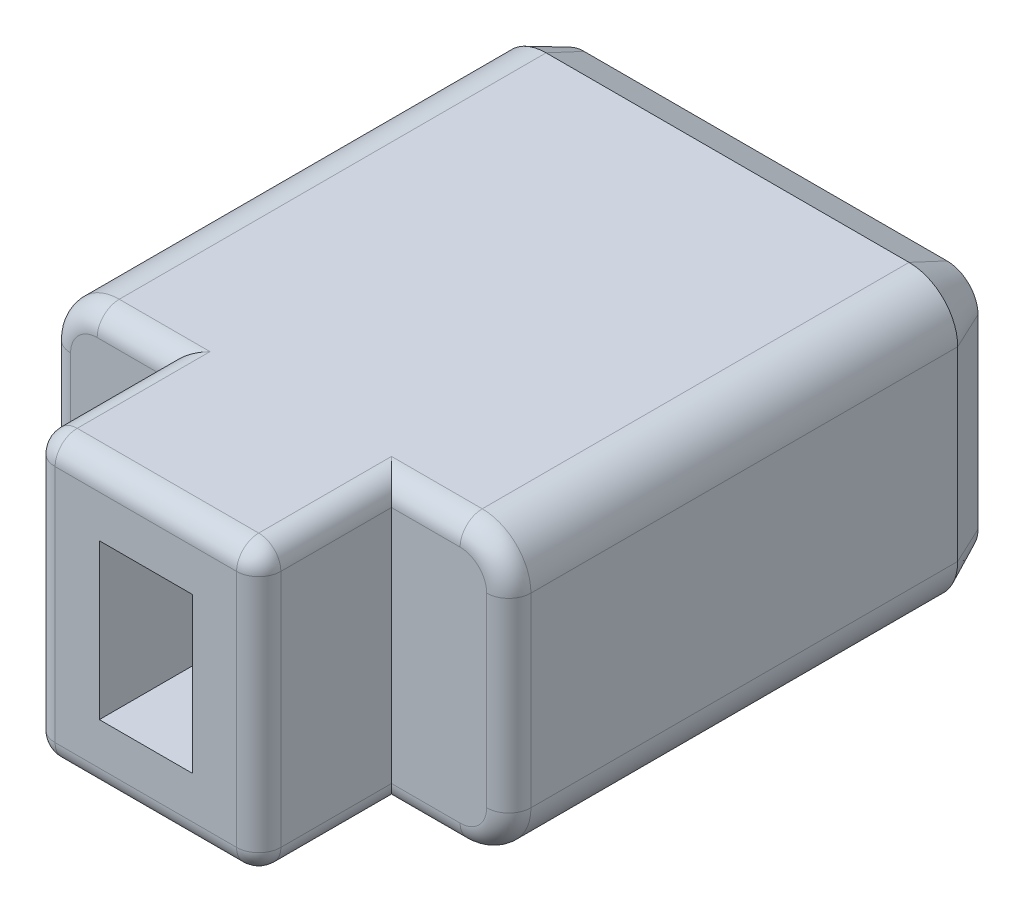
from build123d import *

# Parameters (mm, degrees)
BOSS_EXTRU_1_DEPTH      = 14
ESQUISSE3_W             = 2.1
ESQUISSE3_H             = 3.5
ENL_V_MAT_EXTRU_1_DEPTH = 3
ESQUISSE4_OUTSIDE_W     = 16.116
ESQUISSE4_OUTSIDE_H     = 12.116
ESQUISSE4_OUTSIDE_W_2   = 5.1
ESQUISSE4_OUTSIDE_H_2   = 6.4
ENL_V_MAT_EXTRU_2_DEPTH = 3
CONG_1_R                = 0.5
CHANFREIN1_SIZE         = 0.4
CHANFREIN1_SIZE2        = 0.857802768
ENL_V_MAT_EXTRU_3_DEPTH = 0.3
BOSS_EXTRU_2_DEPTH      = 0.3
BOSS_EXTRU_2_2_DEPTH    = 0.3
BOSS_EXTRU_2_3_DEPTH    = 0.3


with BuildPart() as part:
    # Esquisse2 → Boss.-Extru.1 (new body)
    with BuildSketch(Plane.XY):
        with BuildLine():
            Line((1.1, 0), (9.3, 0))
            ThreePointArc((9.3, 0), (10.077817459, 0.322182541), (10.4, 1.1))
            Line((10.4, 1.1), (10.4, 5.3))
            ThreePointArc((10.4, 5.3), (10.077817459, 6.077817459), (9.3, 6.4))
            Line((9.3, 6.4), (1.1, 6.4))
            ThreePointArc((1.1, 6.4), (0.322182541, 6.077817459), (0, 5.3))
            Line((0, 5.3), (0, 1.1))
            ThreePointArc((0, 1.1), (0.322182541, 0.322182541), (1.1, 0))
        make_face()
    extrude(amount=BOSS_EXTRU_1_DEPTH)

    # Esquisse3 → Enlèv. mat.-Extru.1 (cut)
    with BuildSketch(Plane.XY.offset(14)):
        with Locations((5.2, 3.2)):
            Rectangle(ESQUISSE3_W, ESQUISSE3_H)
    extrude(amount=-ENL_V_MAT_EXTRU_1_DEPTH, mode=Mode.SUBTRACT)

    # Esquisse4 outside → Enlèv. mat.-Extru.2 (cut)
    with BuildSketch(Plane.XY.offset(14)):
        with Locations((5.2, 3.2)):
            Rectangle(ESQUISSE4_OUTSIDE_W, ESQUISSE4_OUTSIDE_H)
        with Locations((5.2, 3.2)):
            Rectangle(ESQUISSE4_OUTSIDE_W_2, ESQUISSE4_OUTSIDE_H_2, mode=Mode.SUBTRACT)
    extrude(amount=-ENL_V_MAT_EXTRU_2_DEPTH, mode=Mode.SUBTRACT)

    # Congé1
    cong_1_edges = [part.edges().sort_by_distance(p)[0] for p in [
        (8.525, 0, 11),
        (10.077817459, 0.322182541, 11),
        (10.4, 3.2, 11),
        (10.077817459, 6.077817459, 11),
        (1.875, 6.4, 11),
        (0.322182541, 6.077817459, 11),
        (1.875, 0, 11),
        (0.322182541, 0.322182541, 11),
        (7.75, 6.4, 12.5),
        (2.65, 6.4, 12.5),
        (7.75, 0, 12.5),
        (2.65, 0, 12.5),
        (2.65, 3.2, 14),
        (5.2, 6.4, 14),
        (7.75, 3.2, 14),
        (5.2, 0, 14),
        (8.525, 6.4, 11),
        (0, 3.2, 11),
    ]]
    fillet(cong_1_edges, radius=CONG_1_R)

    # Chanfrein1
    chanfrein1_edges = [part.edges().sort_by_distance(p)[0] for p in [
        (5.2, 0, 0),
        (10.077817459, 0.322182541, 0),
        (0.322182541, 0.322182541, 0),
        (10.4, 3.2, 0),
        (0, 3.2, 0),
        (10.077817459, 6.077817459, 0),
        (0.322182541, 6.077817459, 0),
        (5.2, 6.4, 0),
    ]]
    chanfrein1_side = [part.faces().sort_by_distance(p)[0] for p in [
        (5.2, 3.2, 0),
    ]]
    chamfer(chanfrein1_edges, length=CHANFREIN1_SIZE, length2=CHANFREIN1_SIZE2, reference=chanfrein1_side[0])

    # Esquisse5 → Enlèv. mat.-Extru.3 (cut)
    # profile 1 of 3: a face of its own
    with BuildSketch(Plane(origin=(0, 0, 0), x_dir=(-1, 0, 0), z_dir=(0, 0, -1))):
        with BuildLine():
            Line((-4.276923077, 2.033974359), (-4.000480769, 2.274358974))
            add(Edge.make_bspline(
                [(-4.000480769, 2.274358974), (-3.962102197, 2.222140609), (-3.886775783, 2.119650549), (-3.755756238, 1.984141613), (-3.613251162, 1.868933007), (-3.460095419, 1.773322739), (-3.29682901, 1.69968982), (-3.125457967, 1.646548969), (-2.946218196, 1.613219489), (-2.823810126, 1.609552821), (-2.761698718, 1.607692308)],
                knots=[0, 0, 0, 0, 1.059844169, 2.080177969, 3.074997252, 4.05282142, 5.027209033, 5.99793136, 6.984124963, 8, 8, 8, 8], degree=3))
            add(Edge.make_bspline(
                [(-2.761698718, 1.607692308), (-2.727474352, 1.608152442), (-2.659369594, 1.609068087), (-2.558253532, 1.62123278), (-2.45882019, 1.638378111), (-2.361532921, 1.663255399), (-2.266556515, 1.696027084), (-2.172534217, 1.733781483), (-2.081443986, 1.780884494), (-1.992377993, 1.833527867), (-1.907144766, 1.892677342), (-1.82605109, 1.956898185), (-1.749694689, 2.02564327), (-1.679105422, 2.100108345), (-1.612383779, 2.178273853), (-1.551325074, 2.261850409), (-1.496181054, 2.350656354), (-1.444797072, 2.443188098), (-1.399109124, 2.540018487), (-1.360034227, 2.640574138), (-1.326030175, 2.743961711), (-1.299222293, 2.850648963), (-1.277282703, 2.959686125), (-1.262071354, 3.071811804), (-1.253313907, 3.18687754), (-1.251963406, 3.264728865), (-1.251282051, 3.30400641)],
                knots=[0, 0, 0, 0, 0.97289461, 1.936011137, 2.892754515, 3.841684151, 4.788238795, 5.748985364, 6.720692793, 7.701769213, 8.6901134, 9.668951799, 10.6424691, 11.609651951, 12.585301174, 13.563874206, 14.550347966, 15.556832669, 16.572962131, 17.592946595, 18.623597964, 19.666496227, 20.719856773, 21.785663574, 22.88282314, 24, 24, 24, 24], degree=3))
            add(Edge.make_bspline(
                [(-1.251282051, 3.30400641), (-1.252296991, 3.363107044), (-1.254287635, 3.479023632), (-1.276329854, 3.64883825), (-1.309111755, 3.811628739), (-1.357692697, 3.966485248), (-1.418706228, 4.11418425), (-1.493512611, 4.254523099), (-1.582914401, 4.386715435), (-1.68417268, 4.510513554), (-1.795775953, 4.622968802), (-1.915058284, 4.722122176), (-2.042287881, 4.805539023), (-2.176366905, 4.873751047), (-2.317892379, 4.927390857), (-2.466681504, 4.964264703), (-2.622262689, 4.988840334), (-2.728482199, 4.991138347), (-2.782532051, 4.992307692)],
                knots=[0, 0, 0, 0, 1.112954785, 2.182885596, 3.221232596, 4.238398056, 5.235647242, 6.228569394, 7.229380626, 8.237855998, 9.237844397, 10.210210665, 11.155206134, 12.098269864, 13.039545894, 14.000171849, 14.982386428, 16, 16, 16, 16], degree=3))
            add(Edge.make_bspline(
                [(-2.782532051, 4.992307692), (-2.841968738, 4.990370489), (-2.959281408, 4.98654695), (-3.131353159, 4.954167609), (-3.296160274, 4.90194349), (-3.45347852, 4.828445211), (-3.602855159, 4.733536845), (-3.744357048, 4.617761095), (-3.879249498, 4.481775907), (-3.959339012, 4.378627877), (-4.000480769, 4.325641026)],
                knots=[0, 0, 0, 0, 0.98701547, 1.94811365, 2.898400414, 3.853494756, 4.825030655, 5.831532994, 6.886064627, 8, 8, 8, 8], degree=3))
            Line((-4.000480769, 4.325641026), (-4.276923077, 4.563621795))
            add(Edge.make_bspline(
                [(-4.276923077, 4.563621795), (-4.255144937, 4.596218141), (-4.211783743, 4.661118837), (-4.140480519, 4.752603201), (-4.065765531, 4.83891057), (-3.987049712, 4.919139706), (-3.904369455, 4.994138271), (-3.816977162, 5.062661573), (-3.726194432, 5.126321568), (-3.631651093, 5.184250318), (-3.533153339, 5.235097115), (-3.432039281, 5.280594637), (-3.327599133, 5.31771745), (-3.220882842, 5.34985195), (-3.110732473, 5.372107074), (-2.998305425, 5.390367274), (-2.882894474, 5.400883872), (-2.804988075, 5.402000874), (-2.765705128, 5.402564103)],
                knots=[0, 0, 0, 0, 1.041374987, 2.073421428, 3.079568686, 4.073273683, 5.058170465, 6.043552977, 7.022087575, 8.003141192, 8.987193764, 9.965779835, 10.946859123, 11.930527725, 12.924384778, 13.93018154, 14.956330036, 16, 16, 16, 16], degree=3))
            add(Edge.make_bspline(
                [(-2.765705128, 5.402564103), (-2.72828973, 5.402267935), (-2.654417621, 5.401683189), (-2.545370148, 5.392066353), (-2.439100683, 5.378934925), (-2.33597401, 5.35932637), (-2.235319604, 5.335948637), (-2.138310249, 5.304703061), (-2.04375213, 5.270139818), (-1.952704211, 5.228667823), (-1.864505778, 5.18240408), (-1.779285018, 5.129955518), (-1.696970644, 5.07231767), (-1.617267081, 5.009733107), (-1.541053686, 4.941422954), (-1.468057536, 4.867532053), (-1.398077871, 4.787962989), (-1.354355413, 4.731593845), (-1.332211538, 4.703044872)],
                knots=[0, 0, 0, 0, 1.082168949, 2.13660973, 3.165131306, 4.179150287, 5.172582136, 6.152699036, 7.125936765, 8.084022289, 9.045033083, 10.005950655, 10.977130504, 11.951134984, 12.93626608, 13.936288924, 14.954803513, 16, 16, 16, 16], degree=3))
            add(Edge.make_bspline(
                [(-1.332211538, 4.703044872), (-1.296738988, 4.653214139), (-1.22594324, 4.55376248), (-1.137944828, 4.392857912), (-1.060969548, 4.226187834), (-0.999171455, 4.050939516), (-0.951337208, 3.868102207), (-0.916775683, 3.677681935), (-0.896708809, 3.47965195), (-0.893791903, 3.345184151), (-0.892307692, 3.276762821)],
                knots=[0, 0, 0, 0, 0.965683317, 1.927300737, 2.89231067, 3.86402428, 4.85897487, 5.875476297, 6.918977332, 8, 8, 8, 8], degree=3))
            add(Edge.make_bspline(
                [(-0.892307692, 3.276762821), (-0.893641785, 3.204830865), (-0.89626433, 3.063427756), (-0.923028592, 2.856006965), (-0.964413002, 2.657347371), (-1.02183253, 2.467032718), (-1.097907298, 2.285878807), (-1.190062555, 2.113288295), (-1.299187382, 1.949475621), (-1.423330644, 1.796266238), (-1.559024846, 1.655602283), (-1.705491993, 1.532776269), (-1.861316237, 1.429935291), (-2.02443932, 1.344118513), (-2.196521784, 1.277857782), (-2.377268642, 1.231747218), (-2.566328305, 1.202894235), (-2.695355103, 1.199274587), (-2.760897436, 1.197435897)],
                knots=[0, 0, 0, 0, 1.106177392, 2.174512289, 3.211769933, 4.225704522, 5.227752973, 6.229708733, 7.231529653, 8.251318105, 9.259716566, 10.234142726, 11.185817729, 12.12689365, 13.064806101, 14.01565564, 14.992003525, 16, 16, 16, 16], degree=3))
            add(Edge.make_bspline(
                [(-2.760897436, 1.197435897), (-2.800716264, 1.197990675), (-2.879692456, 1.199091014), (-2.996673033, 1.209733521), (-3.11086361, 1.227538864), (-3.222200709, 1.251488667), (-3.330735386, 1.281814962), (-3.436006637, 1.319508286), (-3.537956256, 1.36487344), (-3.637260964, 1.415732065), (-3.732536634, 1.473741801), (-3.824045288, 1.536821699), (-3.910770806, 1.606203122), (-3.993481357, 1.680567503), (-4.071056102, 1.760895625), (-4.144576419, 1.846347526), (-4.21331182, 1.937571204), (-4.255622291, 2.001692919), (-4.276923077, 2.033974359)],
                knots=[0, 0, 0, 0, 1.055012498, 2.092499289, 3.109576428, 4.116082065, 5.108754671, 6.093853283, 7.076278279, 8.063967189, 9.048429885, 10.030140686, 11.007324681, 11.989571177, 12.975661001, 13.964490532, 14.975242994, 16, 16, 16, 16], degree=3))
        make_face()
    # profile 2 of 3: a face of its own
    with BuildSketch(Plane(origin=(0, 0, 0), x_dir=(-1, 0, 0), z_dir=(0, 0, -1))):
        Polygon((-4.994871795, 1.3), (-5.353846154, 1.3), (-5.353846154, 4.88974359), (-6.687179487, 4.88974359), (-6.687179487, 5.3), (-4.994871795, 5.3), align=None)
    # profile 3 of 3: a face of its own
    with BuildSketch(Plane(origin=(0, 0, 0), x_dir=(-1, 0, 0), z_dir=(0, 0, -1))):
        with BuildLine():
            Line((-7.251282051, 1.3), (-7.953205128, 1.3))
            add(Edge.make_bspline(
                [(-7.953205128, 1.3), (-8.000213275, 1.3001758), (-8.090229963, 1.300512444), (-8.219280641, 1.30243476), (-8.336500089, 1.307883219), (-8.442114803, 1.312567873), (-8.535809249, 1.321160882), (-8.617721249, 1.329228391), (-8.687831754, 1.340225169), (-8.73022515, 1.350001033), (-8.749679487, 1.354487179)],
                knots=[0, 0, 0, 0, 1.410548186, 2.701082353, 3.872164956, 4.931545487, 5.872643019, 6.694846481, 7.4010648, 8, 8, 8, 8], degree=3))
            add(Edge.make_bspline(
                [(-8.749679487, 1.354487179), (-8.775219142, 1.361740702), (-8.826017329, 1.376167905), (-8.898946116, 1.406439045), (-8.968754039, 1.441506074), (-9.035023293, 1.482432658), (-9.096721357, 1.530293066), (-9.155474521, 1.583010705), (-9.209907746, 1.642142742), (-9.261575252, 1.705691029), (-9.30650735, 1.775470425), (-9.347189404, 1.84848438), (-9.380825789, 1.926168245), (-9.408644542, 2.007354342), (-9.430644393, 2.092501008), (-9.445627938, 2.181499618), (-9.454418557, 2.274448402), (-9.455739755, 2.337641421), (-9.456410256, 2.369711538)],
                knots=[0, 0, 0, 0, 0.953163587, 1.89583545, 2.831398256, 3.758060157, 4.68893587, 5.633315694, 6.590672633, 7.573797765, 8.571889309, 9.568272541, 10.573809546, 11.608637311, 12.649011887, 13.729676081, 14.847822807, 16, 16, 16, 16], degree=3))
            add(Edge.make_bspline(
                [(-9.456410256, 2.369711538), (-9.454663057, 2.422954138), (-9.451262795, 2.526570717), (-9.426392336, 2.677261673), (-9.38336416, 2.81754481), (-9.325595668, 2.948255807), (-9.249802259, 3.065244445), (-9.160162217, 3.169018947), (-9.054573529, 3.255709115), (-8.95606583, 3.316142217), (-8.868912965, 3.354829067), (-8.797494165, 3.381850513), (-8.719199942, 3.402787801), (-8.635563808, 3.421281099), (-8.545937966, 3.43568177), (-8.450458638, 3.445914246), (-8.348859215, 3.452378952), (-8.279069705, 3.453348696), (-8.243269231, 3.453846154)],
                knots=[0, 0, 0, 0, 1.376217794, 2.678287309, 3.93428021, 5.161237768, 6.360266741, 7.524963188, 8.691990789, 9.878588042, 10.499780802, 11.155222415, 11.850483239, 12.59271203, 13.369193386, 14.195792071, 15.07448124, 16, 16, 16, 16], degree=3))
            Line((-8.243269231, 3.453846154), (-9.507692308, 5.3))
            Line((-9.507692308, 5.3), (-9.052564103, 5.3))
            Line((-9.052564103, 5.3), (-7.788141026, 3.453846154))
            Line((-7.788141026, 3.453846154), (-7.61025641, 3.453846154))
            Line((-7.61025641, 3.453846154), (-7.61025641, 5.3))
            Line((-7.61025641, 5.3), (-7.251282051, 5.3))
            Line((-7.251282051, 5.3), (-7.251282051, 1.3))
        make_face()
        with BuildLine():
            Line((-7.61025641, 1.71025641), (-7.61025641, 3.043589744))
            Line((-7.61025641, 3.043589744), (-8.216826923, 3.049198718))
            add(Edge.make_bspline(
                [(-8.216826923, 3.049198718), (-8.245146327, 3.049210151), (-8.300214333, 3.049232382), (-8.379809255, 3.044690832), (-8.453879995, 3.039498774), (-8.522068625, 3.031522413), (-8.584666782, 3.021209602), (-8.641475664, 3.008671123), (-8.692610881, 2.993317462), (-8.752501703, 2.970298044), (-8.820426436, 2.934767812), (-8.891408601, 2.879433289), (-8.953648222, 2.813395636), (-9.004622403, 2.736538502), (-9.047111924, 2.652636038), (-9.074842312, 2.561970672), (-9.094965855, 2.46728064), (-9.096601446, 2.402142615), (-9.097435897, 2.368910256)],
                knots=[0, 0, 0, 0, 1.065115818, 2.071152542, 2.998223466, 3.858177936, 4.652718105, 5.384003046, 6.045176779, 6.659081028, 7.796261142, 8.913693857, 10.029725289, 11.194622041, 12.371932755, 13.553993211, 14.752087226, 16, 16, 16, 16], degree=3))
            add(Edge.make_bspline(
                [(-9.097435897, 2.368910256), (-9.096533537, 2.336760519), (-9.094750785, 2.273243778), (-9.075287125, 2.180651775), (-9.045613537, 2.092194398), (-9.004444137, 2.009394504), (-8.952463507, 1.935229452), (-8.892794911, 1.870951797), (-8.825292308, 1.818145247), (-8.762410283, 1.782945664), (-8.705599613, 1.762101483), (-8.657039222, 1.747469387), (-8.601660647, 1.736739671), (-8.540177939, 1.727226354), (-8.472048164, 1.71912867), (-8.397457945, 1.713725393), (-8.316482527, 1.710490094), (-8.260366501, 1.710336239), (-8.23125, 1.71025641)],
                knots=[0, 0, 0, 0, 1.233968552, 2.43789431, 3.619555944, 4.813196433, 5.977971186, 7.089174201, 8.171406254, 9.260239712, 9.841766941, 10.494663619, 11.20736683, 12.007361027, 12.8859566, 13.843359851, 14.8810003, 16, 16, 16, 16], degree=3))
            Line((-8.23125, 1.71025641), (-7.61025641, 1.71025641))
        make_face(mode=Mode.SUBTRACT)
    extrude(amount=-ENL_V_MAT_EXTRU_3_DEPTH, mode=Mode.SUBTRACT)


with BuildPart() as body_2:
    # Esquisse5<2> → Boss.-Extru.2 (new body)
    with BuildSketch(Plane(origin=(0, 0, 0), x_dir=(-1, 0, 0), z_dir=(0, 0, -1))):
        with BuildLine():
            Line((-4.276923077, 2.033974359), (-4.000480769, 2.274358974))
            add(Edge.make_bspline(
                [(-4.000480769, 2.274358974), (-3.962102197, 2.222140609), (-3.886775783, 2.119650549), (-3.755756238, 1.984141613), (-3.613251162, 1.868933007), (-3.460095419, 1.773322739), (-3.29682901, 1.69968982), (-3.125457967, 1.646548969), (-2.946218196, 1.613219489), (-2.823810126, 1.609552821), (-2.761698718, 1.607692308)],
                knots=[0, 0, 0, 0, 1.059844169, 2.080177969, 3.074997252, 4.05282142, 5.027209033, 5.99793136, 6.984124963, 8, 8, 8, 8], degree=3))
            add(Edge.make_bspline(
                [(-2.761698718, 1.607692308), (-2.727474352, 1.608152442), (-2.659369594, 1.609068087), (-2.558253532, 1.62123278), (-2.45882019, 1.638378111), (-2.361532921, 1.663255399), (-2.266556515, 1.696027084), (-2.172534217, 1.733781483), (-2.081443986, 1.780884494), (-1.992377993, 1.833527867), (-1.907144766, 1.892677342), (-1.82605109, 1.956898185), (-1.749694689, 2.02564327), (-1.679105422, 2.100108345), (-1.612383779, 2.178273853), (-1.551325074, 2.261850409), (-1.496181054, 2.350656354), (-1.444797072, 2.443188098), (-1.399109124, 2.540018487), (-1.360034227, 2.640574138), (-1.326030175, 2.743961711), (-1.299222293, 2.850648963), (-1.277282703, 2.959686125), (-1.262071354, 3.071811804), (-1.253313907, 3.18687754), (-1.251963406, 3.264728865), (-1.251282051, 3.30400641)],
                knots=[0, 0, 0, 0, 0.97289461, 1.936011137, 2.892754515, 3.841684151, 4.788238795, 5.748985364, 6.720692793, 7.701769213, 8.6901134, 9.668951799, 10.6424691, 11.609651951, 12.585301174, 13.563874206, 14.550347966, 15.556832669, 16.572962131, 17.592946595, 18.623597964, 19.666496227, 20.719856773, 21.785663574, 22.88282314, 24, 24, 24, 24], degree=3))
            add(Edge.make_bspline(
                [(-1.251282051, 3.30400641), (-1.252296991, 3.363107044), (-1.254287635, 3.479023632), (-1.276329854, 3.64883825), (-1.309111755, 3.811628739), (-1.357692697, 3.966485248), (-1.418706228, 4.11418425), (-1.493512611, 4.254523099), (-1.582914401, 4.386715435), (-1.68417268, 4.510513554), (-1.795775953, 4.622968802), (-1.915058284, 4.722122176), (-2.042287881, 4.805539023), (-2.176366905, 4.873751047), (-2.317892379, 4.927390857), (-2.466681504, 4.964264703), (-2.622262689, 4.988840334), (-2.728482199, 4.991138347), (-2.782532051, 4.992307692)],
                knots=[0, 0, 0, 0, 1.112954785, 2.182885596, 3.221232596, 4.238398056, 5.235647242, 6.228569394, 7.229380626, 8.237855998, 9.237844397, 10.210210665, 11.155206134, 12.098269864, 13.039545894, 14.000171849, 14.982386428, 16, 16, 16, 16], degree=3))
            add(Edge.make_bspline(
                [(-2.782532051, 4.992307692), (-2.841968738, 4.990370489), (-2.959281408, 4.98654695), (-3.131353159, 4.954167609), (-3.296160274, 4.90194349), (-3.45347852, 4.828445211), (-3.602855159, 4.733536845), (-3.744357048, 4.617761095), (-3.879249498, 4.481775907), (-3.959339012, 4.378627877), (-4.000480769, 4.325641026)],
                knots=[0, 0, 0, 0, 0.98701547, 1.94811365, 2.898400414, 3.853494756, 4.825030655, 5.831532994, 6.886064627, 8, 8, 8, 8], degree=3))
            Line((-4.000480769, 4.325641026), (-4.276923077, 4.563621795))
            add(Edge.make_bspline(
                [(-4.276923077, 4.563621795), (-4.255144937, 4.596218141), (-4.211783743, 4.661118837), (-4.140480519, 4.752603201), (-4.065765531, 4.83891057), (-3.987049712, 4.919139706), (-3.904369455, 4.994138271), (-3.816977162, 5.062661573), (-3.726194432, 5.126321568), (-3.631651093, 5.184250318), (-3.533153339, 5.235097115), (-3.432039281, 5.280594637), (-3.327599133, 5.31771745), (-3.220882842, 5.34985195), (-3.110732473, 5.372107074), (-2.998305425, 5.390367274), (-2.882894474, 5.400883872), (-2.804988075, 5.402000874), (-2.765705128, 5.402564103)],
                knots=[0, 0, 0, 0, 1.041374987, 2.073421428, 3.079568686, 4.073273683, 5.058170465, 6.043552977, 7.022087575, 8.003141192, 8.987193764, 9.965779835, 10.946859123, 11.930527725, 12.924384778, 13.93018154, 14.956330036, 16, 16, 16, 16], degree=3))
            add(Edge.make_bspline(
                [(-2.765705128, 5.402564103), (-2.72828973, 5.402267935), (-2.654417621, 5.401683189), (-2.545370148, 5.392066353), (-2.439100683, 5.378934925), (-2.33597401, 5.35932637), (-2.235319604, 5.335948637), (-2.138310249, 5.304703061), (-2.04375213, 5.270139818), (-1.952704211, 5.228667823), (-1.864505778, 5.18240408), (-1.779285018, 5.129955518), (-1.696970644, 5.07231767), (-1.617267081, 5.009733107), (-1.541053686, 4.941422954), (-1.468057536, 4.867532053), (-1.398077871, 4.787962989), (-1.354355413, 4.731593845), (-1.332211538, 4.703044872)],
                knots=[0, 0, 0, 0, 1.082168949, 2.13660973, 3.165131306, 4.179150287, 5.172582136, 6.152699036, 7.125936765, 8.084022289, 9.045033083, 10.005950655, 10.977130504, 11.951134984, 12.93626608, 13.936288924, 14.954803513, 16, 16, 16, 16], degree=3))
            add(Edge.make_bspline(
                [(-1.332211538, 4.703044872), (-1.296738988, 4.653214139), (-1.22594324, 4.55376248), (-1.137944828, 4.392857912), (-1.060969548, 4.226187834), (-0.999171455, 4.050939516), (-0.951337208, 3.868102207), (-0.916775683, 3.677681935), (-0.896708809, 3.47965195), (-0.893791903, 3.345184151), (-0.892307692, 3.276762821)],
                knots=[0, 0, 0, 0, 0.965683317, 1.927300737, 2.89231067, 3.86402428, 4.85897487, 5.875476297, 6.918977332, 8, 8, 8, 8], degree=3))
            add(Edge.make_bspline(
                [(-0.892307692, 3.276762821), (-0.893641785, 3.204830865), (-0.89626433, 3.063427756), (-0.923028592, 2.856006965), (-0.964413002, 2.657347371), (-1.02183253, 2.467032718), (-1.097907298, 2.285878807), (-1.190062555, 2.113288295), (-1.299187382, 1.949475621), (-1.423330644, 1.796266238), (-1.559024846, 1.655602283), (-1.705491993, 1.532776269), (-1.861316237, 1.429935291), (-2.02443932, 1.344118513), (-2.196521784, 1.277857782), (-2.377268642, 1.231747218), (-2.566328305, 1.202894235), (-2.695355103, 1.199274587), (-2.760897436, 1.197435897)],
                knots=[0, 0, 0, 0, 1.106177392, 2.174512289, 3.211769933, 4.225704522, 5.227752973, 6.229708733, 7.231529653, 8.251318105, 9.259716566, 10.234142726, 11.185817729, 12.12689365, 13.064806101, 14.01565564, 14.992003525, 16, 16, 16, 16], degree=3))
            add(Edge.make_bspline(
                [(-2.760897436, 1.197435897), (-2.800716264, 1.197990675), (-2.879692456, 1.199091014), (-2.996673033, 1.209733521), (-3.11086361, 1.227538864), (-3.222200709, 1.251488667), (-3.330735386, 1.281814962), (-3.436006637, 1.319508286), (-3.537956256, 1.36487344), (-3.637260964, 1.415732065), (-3.732536634, 1.473741801), (-3.824045288, 1.536821699), (-3.910770806, 1.606203122), (-3.993481357, 1.680567503), (-4.071056102, 1.760895625), (-4.144576419, 1.846347526), (-4.21331182, 1.937571204), (-4.255622291, 2.001692919), (-4.276923077, 2.033974359)],
                knots=[0, 0, 0, 0, 1.055012498, 2.092499289, 3.109576428, 4.116082065, 5.108754671, 6.093853283, 7.076278279, 8.063967189, 9.048429885, 10.030140686, 11.007324681, 11.989571177, 12.975661001, 13.964490532, 14.975242994, 16, 16, 16, 16], degree=3))
        make_face()
    extrude(amount=BOSS_EXTRU_2_DEPTH)


with BuildPart() as body_3:
    # Esquisse5<2> → Boss.-Extru.2 2 (new body)
    with BuildSketch(Plane(origin=(0, 0, 0), x_dir=(-1, 0, 0), z_dir=(0, 0, -1))):
        Polygon((-4.994871795, 1.3), (-5.353846154, 1.3), (-5.353846154, 4.88974359), (-6.687179487, 4.88974359), (-6.687179487, 5.3), (-4.994871795, 5.3), align=None)
    extrude(amount=BOSS_EXTRU_2_2_DEPTH)


with BuildPart() as body_4:
    # Esquisse5<2> → Boss.-Extru.2 3 (new body)
    with BuildSketch(Plane(origin=(0, 0, 0), x_dir=(-1, 0, 0), z_dir=(0, 0, -1))):
        with BuildLine():
            Line((-7.251282051, 1.3), (-7.953205128, 1.3))
            add(Edge.make_bspline(
                [(-7.953205128, 1.3), (-8.000213275, 1.3001758), (-8.090229963, 1.300512444), (-8.219280641, 1.30243476), (-8.336500089, 1.307883219), (-8.442114803, 1.312567873), (-8.535809249, 1.321160882), (-8.617721249, 1.329228391), (-8.687831754, 1.340225169), (-8.73022515, 1.350001033), (-8.749679487, 1.354487179)],
                knots=[0, 0, 0, 0, 1.410548186, 2.701082353, 3.872164956, 4.931545487, 5.872643019, 6.694846481, 7.4010648, 8, 8, 8, 8], degree=3))
            add(Edge.make_bspline(
                [(-8.749679487, 1.354487179), (-8.775219142, 1.361740702), (-8.826017329, 1.376167905), (-8.898946116, 1.406439045), (-8.968754039, 1.441506074), (-9.035023293, 1.482432658), (-9.096721357, 1.530293066), (-9.155474521, 1.583010705), (-9.209907746, 1.642142742), (-9.261575252, 1.705691029), (-9.30650735, 1.775470425), (-9.347189404, 1.84848438), (-9.380825789, 1.926168245), (-9.408644542, 2.007354342), (-9.430644393, 2.092501008), (-9.445627938, 2.181499618), (-9.454418557, 2.274448402), (-9.455739755, 2.337641421), (-9.456410256, 2.369711538)],
                knots=[0, 0, 0, 0, 0.953163587, 1.89583545, 2.831398256, 3.758060157, 4.68893587, 5.633315694, 6.590672633, 7.573797765, 8.571889309, 9.568272541, 10.573809546, 11.608637311, 12.649011887, 13.729676081, 14.847822807, 16, 16, 16, 16], degree=3))
            add(Edge.make_bspline(
                [(-9.456410256, 2.369711538), (-9.454663057, 2.422954138), (-9.451262795, 2.526570717), (-9.426392336, 2.677261673), (-9.38336416, 2.81754481), (-9.325595668, 2.948255807), (-9.249802259, 3.065244445), (-9.160162217, 3.169018947), (-9.054573529, 3.255709115), (-8.95606583, 3.316142217), (-8.868912965, 3.354829067), (-8.797494165, 3.381850513), (-8.719199942, 3.402787801), (-8.635563808, 3.421281099), (-8.545937966, 3.43568177), (-8.450458638, 3.445914246), (-8.348859215, 3.452378952), (-8.279069705, 3.453348696), (-8.243269231, 3.453846154)],
                knots=[0, 0, 0, 0, 1.376217794, 2.678287309, 3.93428021, 5.161237768, 6.360266741, 7.524963188, 8.691990789, 9.878588042, 10.499780802, 11.155222415, 11.850483239, 12.59271203, 13.369193386, 14.195792071, 15.07448124, 16, 16, 16, 16], degree=3))
            Line((-8.243269231, 3.453846154), (-9.507692308, 5.3))
            Line((-9.507692308, 5.3), (-9.052564103, 5.3))
            Line((-9.052564103, 5.3), (-7.788141026, 3.453846154))
            Line((-7.788141026, 3.453846154), (-7.61025641, 3.453846154))
            Line((-7.61025641, 3.453846154), (-7.61025641, 5.3))
            Line((-7.61025641, 5.3), (-7.251282051, 5.3))
            Line((-7.251282051, 5.3), (-7.251282051, 1.3))
        make_face()
        with BuildLine():
            Line((-7.61025641, 1.71025641), (-7.61025641, 3.043589744))
            Line((-7.61025641, 3.043589744), (-8.216826923, 3.049198718))
            add(Edge.make_bspline(
                [(-8.216826923, 3.049198718), (-8.245146327, 3.049210151), (-8.300214333, 3.049232382), (-8.379809255, 3.044690832), (-8.453879995, 3.039498774), (-8.522068625, 3.031522413), (-8.584666782, 3.021209602), (-8.641475664, 3.008671123), (-8.692610881, 2.993317462), (-8.752501703, 2.970298044), (-8.820426436, 2.934767812), (-8.891408601, 2.879433289), (-8.953648222, 2.813395636), (-9.004622403, 2.736538502), (-9.047111924, 2.652636038), (-9.074842312, 2.561970672), (-9.094965855, 2.46728064), (-9.096601446, 2.402142615), (-9.097435897, 2.368910256)],
                knots=[0, 0, 0, 0, 1.065115818, 2.071152542, 2.998223466, 3.858177936, 4.652718105, 5.384003046, 6.045176779, 6.659081028, 7.796261142, 8.913693857, 10.029725289, 11.194622041, 12.371932755, 13.553993211, 14.752087226, 16, 16, 16, 16], degree=3))
            add(Edge.make_bspline(
                [(-9.097435897, 2.368910256), (-9.096533537, 2.336760519), (-9.094750785, 2.273243778), (-9.075287125, 2.180651775), (-9.045613537, 2.092194398), (-9.004444137, 2.009394504), (-8.952463507, 1.935229452), (-8.892794911, 1.870951797), (-8.825292308, 1.818145247), (-8.762410283, 1.782945664), (-8.705599613, 1.762101483), (-8.657039222, 1.747469387), (-8.601660647, 1.736739671), (-8.540177939, 1.727226354), (-8.472048164, 1.71912867), (-8.397457945, 1.713725393), (-8.316482527, 1.710490094), (-8.260366501, 1.710336239), (-8.23125, 1.71025641)],
                knots=[0, 0, 0, 0, 1.233968552, 2.43789431, 3.619555944, 4.813196433, 5.977971186, 7.089174201, 8.171406254, 9.260239712, 9.841766941, 10.494663619, 11.20736683, 12.007361027, 12.8859566, 13.843359851, 14.8810003, 16, 16, 16, 16], degree=3))
            Line((-8.23125, 1.71025641), (-7.61025641, 1.71025641))
        make_face(mode=Mode.SUBTRACT)
    extrude(amount=BOSS_EXTRU_2_3_DEPTH)


solid = Compound([part.part, body_2.part, body_3.part, body_4.part])
